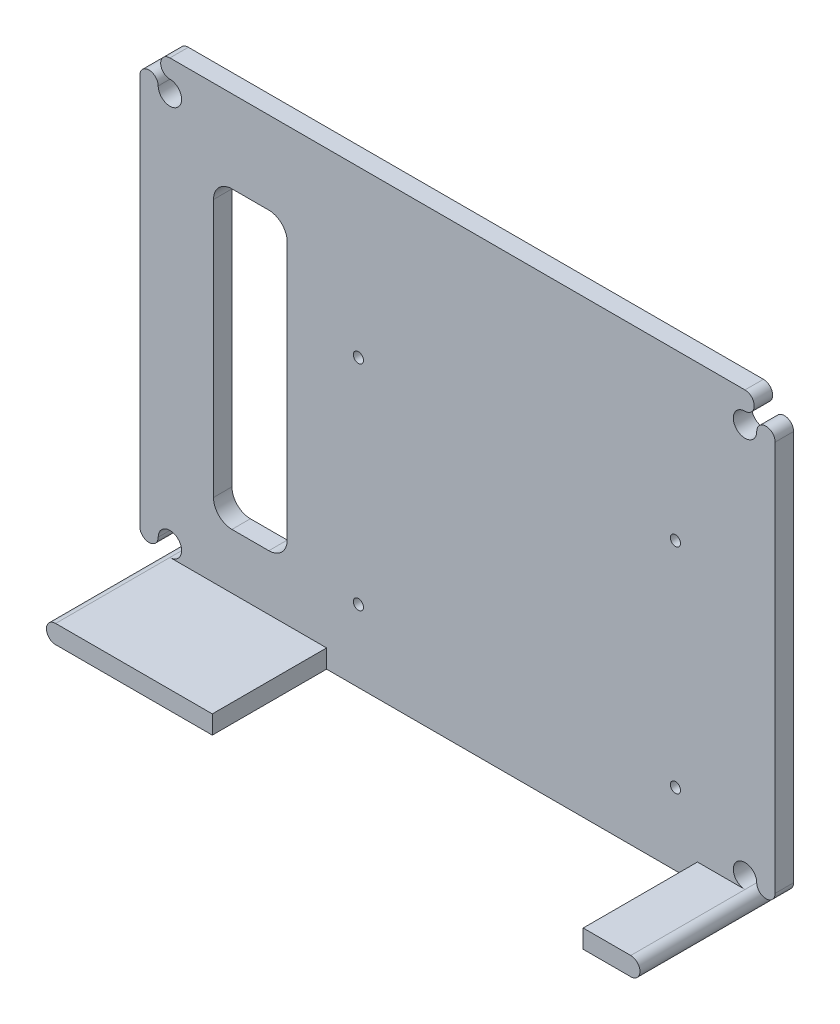
from build123d import *

# Parameters (mm, degrees)
RESSALTO_EXTRUS_O1_DEPTH = 5
RESSALTO_EXTRUS_O2_DEPTH = 31
ESBO_O3_R                = 1.38
CORTE_EXTRUS_O1_DEPTH    = 5
CORTE_EXTRUS_O2_DEPTH    = 5


with BuildPart() as part:
    # Esboço1 → Ressalto-extrusão1 (new body)
    with BuildSketch(Plane.XY):
        with BuildLine():
            Line((-78, -61.175), (78, -61.175))
            ThreePointArc((78, -61.175), (80.5, -58.675), (78, -56.175))
            ThreePointArc((78, -56.175), (75.75493597, -50.75493597), (81.175, -53))
            ThreePointArc((81.175, -53), (83.675, -55.5), (86.175, -53))
            Line((86.175, -53), (86.175, 53))
            ThreePointArc((86.175, 53), (83.675, 55.5), (81.175, 53))
            ThreePointArc((81.175, 53), (75.756150129, 50.753722467), (77.996566768, 56.174998144))
            ThreePointArc((77.996566768, 56.174998144), (80.493861975, 58.677700014), (77.991160104, 61.174995221))
            Line((77.991160104, 61.174995221), (-78, 61.174995221))
            ThreePointArc((-78, 61.174995221), (-80.5, 58.674995221), (-78, 56.174995221))
            ThreePointArc((-78, 56.174995221), (-75.75493597, 50.75493119), (-81.175, 52.999995221))
            ThreePointArc((-81.175, 52.999995221), (-83.675, 55.499995221), (-86.175, 52.999995221))
            Line((-86.175, 52.999995221), (-86.175, -53))
            ThreePointArc((-86.175, -53), (-83.675, -55.5), (-81.175, -53))
            ThreePointArc((-81.175, -53), (-75.75493597, -50.75493597), (-78, -56.175))
            ThreePointArc((-78, -56.175), (-80.5, -58.675), (-78, -61.175))
        make_face()
    extrude(amount=RESSALTO_EXTRUS_O1_DEPTH)

    # Esboço2 → Ressalto-extrusão2 (add)
    with BuildSketch(Plane.XY.offset(5)):
        with BuildLine():
            Line((-78, -56.175), (-35.5, -56.175))
            Line((-35.5, -56.175), (-35.5, -60.212223694))
            Line((-35.5, -60.212223694), (-35.5, -61.175))
            Line((-35.5, -61.175), (-78, -61.175))
            ThreePointArc((-78, -61.175), (-80.5, -58.675), (-78, -56.175))
        make_face()
        with BuildLine():
            Line((78, -61.175), (65.099265532, -61.175))
            Line((65.099265532, -61.175), (65.099265532, -56.175))
            Line((65.099265532, -56.175), (78, -56.175))
            ThreePointArc((78, -56.175), (80.5, -58.675), (78, -61.175))
        make_face()
    extrude(amount=RESSALTO_EXTRUS_O2_DEPTH)

    # Esboço3 → Corte-extrusão1 (cut)
    with BuildSketch(Plane.XY.offset(5)):
        with Locations((59.125349465, -41.637776306)):
            Circle(ESBO_O3_R)
        with Locations((59.125349465, 16.362223694)):
            Circle(ESBO_O3_R)
        with Locations((-26.874650535, -41.637776306)):
            Circle(ESBO_O3_R)
        with Locations((-26.874650535, 16.362223694)):
            Circle(ESBO_O3_R)
    extrude(amount=-CORTE_EXTRUS_O1_DEPTH, mode=Mode.SUBTRACT)

    # Esboço4 → Corte-extrusão2 (cut)
    with BuildSketch(Plane.XY.offset(5)):
        with BuildLine():
            Line((-61.175, 38.825), (-51.175, 38.825))
            ThreePointArc((-51.175, 38.825), (-47.639466094, 37.360533906), (-46.175, 33.825))
            Line((-46.175, 33.825), (-46.175, -36.175))
            ThreePointArc((-46.175, -36.175), (-47.639466094, -39.710533906), (-51.175, -41.175))
            Line((-51.175, -41.175), (-61.175, -41.175))
            ThreePointArc((-61.175, -41.175), (-64.710533906, -39.710533906), (-66.175, -36.175))
            Line((-66.175, -36.175), (-66.175, 33.825))
            ThreePointArc((-66.175, 33.825), (-64.710533906, 37.360533906), (-61.175, 38.825))
        make_face()
    extrude(amount=-CORTE_EXTRUS_O2_DEPTH, mode=Mode.SUBTRACT)


solid = part.part
